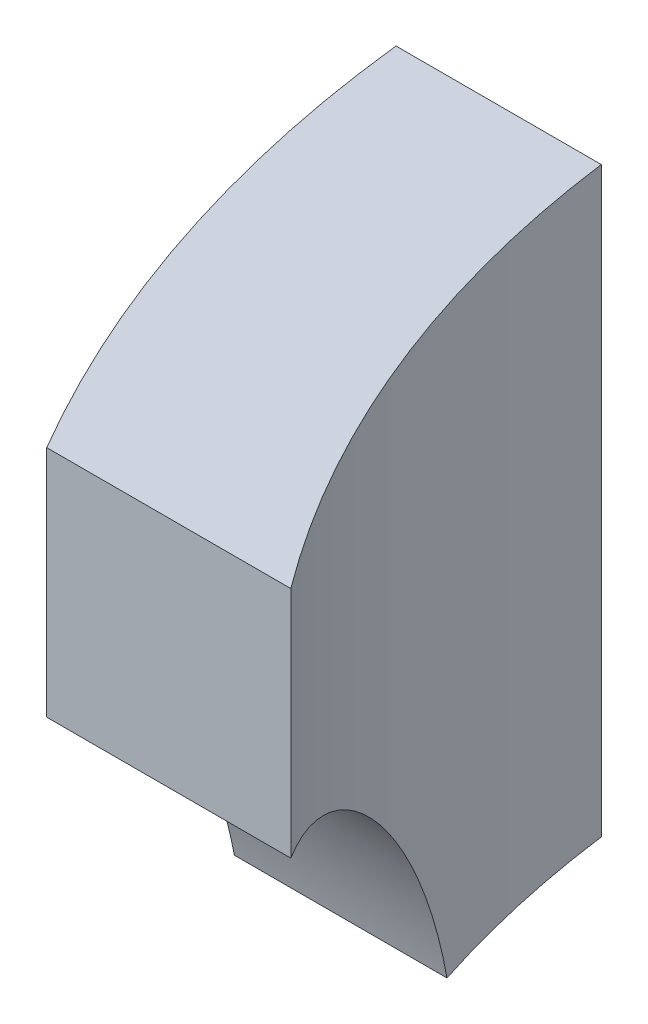
from build123d import *

# Parameters (mm, degrees)
BOSS_EXTRUDE1_DEPTH      = 60
SKETCH25_W               = 5.5
SKETCH25_H               = 17
BOSS_EXTRUDE3_DEPTH      = 20
FILLET1_R                = 2.3
SKETCH28_W               = 8
SKETCH28_H               = 10
CUT_EXTRUDE17_DEPTH      = 265
CUT_EXTRUDE19_DEPTH      = 165.638713704
CUT_EXTRUDE19_DEPTH_BACK = 165.638713704
SKETCH30_W               = 183.61
SKETCH30_H               = 30
CUT_EXTRUDE20_DEPTH      = 165.638713704
CUT_EXTRUDE20_DEPTH_BACK = 165.638713704
SKETCH32_W               = 3
SKETCH32_H               = 14
CUT_EXTRUDE23_DEPTH      = 44
CUT_EXTRUDE23_DEPTH_BACK = 254
SKETCH40_W               = 29.770973954
SKETCH40_H               = 62.053600945
SKETCH41_R               = 3
CUT_EXTRUDE24_DEPTH      = 254
BOSS_EXTRUDE4_DEPTH      = 40
CUT_EXTRUDE21_DEPTH      = 90
CUT_EXTRUDE22_DEPTH      = 164.320868502
CUT_EXTRUDE22_DEPTH_BACK = 164.320868502


with BuildPart() as part:
    # Sketch1 → Boss-Extrude1 (new body)
    with BuildSketch(Plane(origin=(0, 0, 0), x_dir=(1, 0, 0), z_dir=(0, 1, 0))):
        with BuildLine():
            Line((91.805, -10), (90.252689849, -10))
            ThreePointArc((90.252689849, -10), (0, -90.805), (-90.252689849, -10))
            Line((-90.252689849, -10), (-91.805, -10))
            Line((-91.805, -10), (-91.805, 20))
            Line((-91.805, 20), (-76.805, 20))
            Line((-76.805, 20), (-76.805, 0))
            ThreePointArc((-76.805, 0), (0, -76.805), (76.805, 0))
            Line((76.805, 0), (76.805, 20))
            Line((76.805, 20), (91.805, 20))
            Line((91.805, 20), (91.805, -10))
        make_face()
    extrude(amount=-BOSS_EXTRUDE1_DEPTH)

    # Sketch25 → Boss-Extrude3 (add)
    with BuildSketch(Plane(origin=(0, -60, 0), x_dir=(-1, 0, 0), z_dir=(0, -1, 0))):
        with Locations((84.305, 5)):
            Rectangle(SKETCH25_W, SKETCH25_H)
        with Locations((-84.305, 5)):
            Rectangle(SKETCH25_W, SKETCH25_H)
    extrude(amount=BOSS_EXTRUDE3_DEPTH)

    # Fillet1
    fillet1_edges = [part.edges().sort_by_distance(p)[0] for p in [
        (84.305, -60, 3.5),
        (81.555, -60, -5),
        (87.055, -60, -5),
        (84.305, -60, -13.5),
        (-84.305, -60, 3.5),
        (-87.055, -60, -5),
        (-81.555, -60, -5),
        (-84.305, -60, -13.5),
    ]]
    fillet(fillet1_edges, radius=FILLET1_R)

    # Sketch28 → Cut-Extrude17 (cut)
    with BuildSketch(Plane(origin=(91.805, 0, 0), x_dir=(0, 0, -1), z_dir=(1, 0, 0))):
        with Locations((5, -42)):
            Rectangle(SKETCH28_W, SKETCH28_H)
    extrude(amount=-CUT_EXTRUDE17_DEPTH, mode=Mode.SUBTRACT)

    # Sketch30 → Cut-Extrude19 (cut, two sides: drawn at the far end of the back side and taken through both)
    with BuildSketch(Plane(origin=(0, 0, -20), x_dir=(-1, 0, 0), z_dir=(0, 0, -1)).offset(-CUT_EXTRUDE19_DEPTH_BACK)):
        with Locations((0, -15)):
            Rectangle(SKETCH30_W, SKETCH30_H)
    extrude(amount=CUT_EXTRUDE19_DEPTH + CUT_EXTRUDE19_DEPTH_BACK, mode=Mode.SUBTRACT)

    # Sketch32 → Cut-Extrude20 (cut, two sides: drawn at the far end of the back side and taken through both)
    with BuildSketch(Plane(origin=(0, 0, -20), x_dir=(-1, 0, 0), z_dir=(0, 0, -1)).offset(-CUT_EXTRUDE20_DEPTH_BACK)):
        with Locations((51.773928511, -44)):
            Rectangle(SKETCH32_W, SKETCH32_H)
        with Locations((-65.13523483, -44)):
            Rectangle(SKETCH32_W, SKETCH32_H)
        with Locations((-51.773928511, -44)):
            Rectangle(SKETCH32_W, SKETCH32_H)
        with Locations((65.13523483, -44)):
            Rectangle(SKETCH32_W, SKETCH32_H)
    extrude(amount=CUT_EXTRUDE20_DEPTH + CUT_EXTRUDE20_DEPTH_BACK, mode=Mode.SUBTRACT)

    # Sketch40 → Cut-Extrude23 (cut, two sides: drawn at the far end of the back side and taken through both)
    with BuildSketch(Plane.ZY.offset(87.055).offset(-CUT_EXTRUDE23_DEPTH_BACK)):
        with Locations((-5.114513023, -61.026800472)):
            Rectangle(SKETCH40_W, SKETCH40_H)
    extrude(amount=CUT_EXTRUDE23_DEPTH + CUT_EXTRUDE23_DEPTH_BACK, mode=Mode.SUBTRACT)

    # Sketch41 → Cut-Extrude24 (cut)
    with BuildSketch(Plane(origin=(0, 0, 9.770973954), x_dir=(-1, 0, 0), z_dir=(0, 0, -1))):
        with Locations((-83.992971555, -37.5)):
            Circle(SKETCH41_R)
        with Locations((-83.992971555, -52.5)):
            Circle(SKETCH41_R)
        with Locations((83.992971555, -52.5)):
            Circle(SKETCH41_R)
        with Locations((83.992971555, -37.5)):
            Circle(SKETCH41_R)
    extrude(amount=-CUT_EXTRUDE24_DEPTH, mode=Mode.SUBTRACT)

    # Sketch33 → Boss-Extrude4 (add)
    with BuildSketch(Plane(origin=(0, -60, 0), x_dir=(-1, 0, 0), z_dir=(0, -1, 0))):
        with BuildLine():
            Line((90.252689849, -10), (76.151218145, -10))
            ThreePointArc((76.151218145, -10), (71.169996018, -28.876282513), (61.590580503, -45.886909008))
            Line((61.590580503, -45.886909008), (73.898492454, -52.768938193))
            ThreePointArc((73.898492454, -52.768938193), (84.815671791, -32.432234638), (90.252689849, -10))
        make_face()
    extrude(amount=BOSS_EXTRUDE4_DEPTH)

    # Sketch37 → Cut-Extrude21 (cut)
    with BuildSketch(Plane(origin=(0, 0, 0), x_dir=(0, 0, -1), z_dir=(1, 0, 0))):
        with BuildLine():
            Line((-0.881303102, -100), (-23.690614963, -100))
            ThreePointArc((-23.690614963, -100), (-31.684760451, -85.14357588), (-45.886909008, -76.037606625))
            Line((-45.886909008, -76.037606625), (-45.886909008, -59.917167305))
            Line((-45.886909008, -59.917167305), (-66.948234535, -59.917167305))
            Line((-66.948234535, -59.917167305), (-63.746381293, -92.441906362))
            Line((-63.746381293, -92.441906362), (-47.571757556, -115.346464391))
            Line((-47.571757556, -115.346464391), (-8.086377987, -115.346464391))
            Line((-8.086377987, -115.346464391), (-0.881303102, -100))
        make_face()
    extrude(amount=-CUT_EXTRUDE21_DEPTH, mode=Mode.SUBTRACT)

    # Sketch38 → Cut-Extrude22 (cut, two sides: drawn at the far end of the back side and taken through both)
    with BuildSketch(Plane(origin=(0, 0, 0), x_dir=(0, 0, -1), z_dir=(1, 0, 0)).offset(-CUT_EXTRUDE22_DEPTH_BACK)):
        Polygon((20, -30), (-90.805, -30), (-90.805, -60), (-10, -60), (-10, -100), (20, -100), (20, -60), align=None)
    extrude(amount=CUT_EXTRUDE22_DEPTH + CUT_EXTRUDE22_DEPTH_BACK, mode=Mode.SUBTRACT)


solid = part.part
